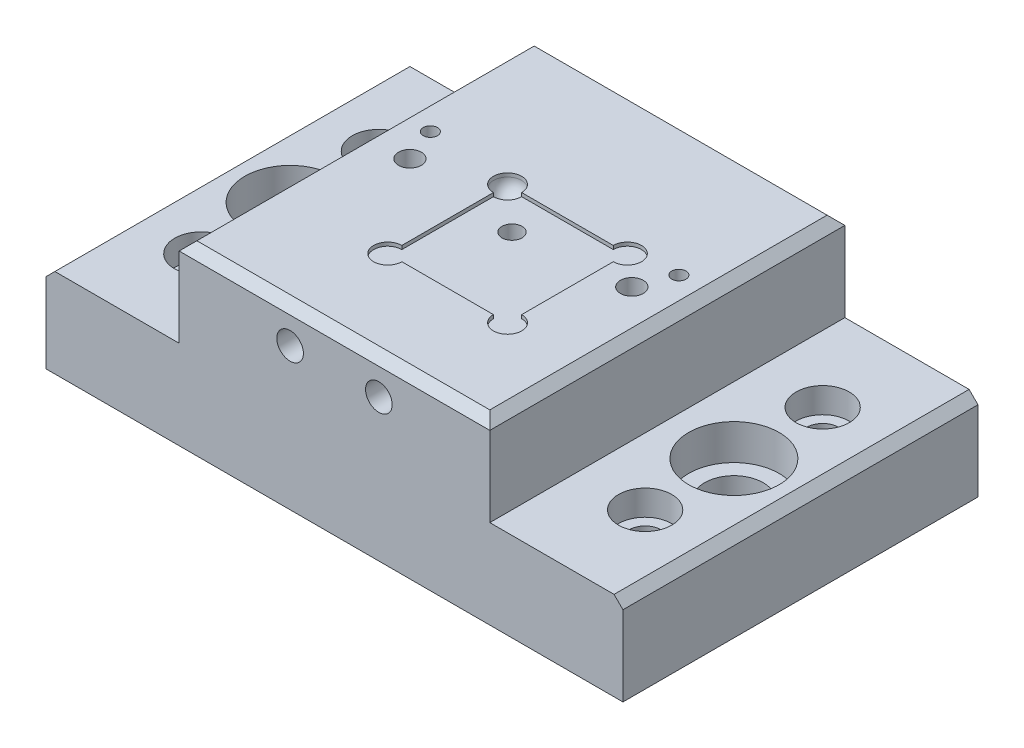
from build123d import *

# Parameters (mm, degrees)
BOSS_EXTRUDE1_DEPTH       = 40
CUT_EXTRUDE1_DEPTH        = 0.4064
SKETCH3_R                 = 1.8
CUT_EXTRUDE2_DEPTH        = 77.974021592
SKETCH5_R                 = 1.1303
CUT_EXTRUDE3_DEPTH        = 10
SKETCH7_R                 = 1.1303
CUT_EXTRUDE4_DEPTH        = 22
CHAMFER1_SIZE             = 1
SKETCH8_R                 = 1.5
CUT_EXTRUDE5_DEPTH        = 79.89866919
SKETCH10_R                = 0.8
CUT_EXTRUDE7_DEPTH        = 8
SKETCH12_R                = 3
CUT_EXTRUDE9_DEPTH        = 2.8448
SKETCH14_R                = 3.3
CUT_EXTRUDE11_DEPTH       = 77.974021592
SKETCH15_R                = 5.1
CUT_EXTRUDE12_DEPTH       = 4
SKETCH16_R                = 3.3
CUT_EXTRUDE13_DEPTH       = 77.974021592
SKETCH17_R                = 5.1
CUT_EXTRUDE14_DEPTH       = 4
F_5_40_TAPPED_HOLE1_D     = 2.5781
F_5_40_TAPPED_HOLE1_DEPTH = 15
F_5_40_TAPPED_HOLE1_TIP   = 0.774539381
SKETCH28_R                = 2.54
CUT_EXTRUDE15_DEPTH       = 5


with BuildPart() as part:
    # Sketch1 → Boss-Extrude1 (new body)
    with BuildSketch(Plane.XY):
        Polygon((0, 0), (65, 0), (65, 10), (50, 10), (50, 20), (15, 20), (15, 10), (0, 10), align=None)
    extrude(amount=BOSS_EXTRUDE1_DEPTH)

    # Sketch2 → Cut-Extrude1 (cut)
    with BuildSketch(Plane(origin=(0, 20, 0), x_dir=(1, 0, 0), z_dir=(0, 1, 0))):
        with BuildLine():
            Line((29.5875, -16), (39.91, -16))
            ThreePointArc((39.91, -16), (42.624299782, -14.875700218), (41.5, -17.59))
            Line((41.5, -17.59), (41.5, -27.91))
            ThreePointArc((41.5, -27.91), (42.624299782, -30.624299782), (39.91, -29.5))
            Line((39.91, -29.5), (29.59, -29.5))
            ThreePointArc((29.59, -29.5), (26.875700218, -30.624299782), (28, -27.91))
            Line((28, -27.91), (28, -17.5875))
            ThreePointArc((28, -17.5875), (26.877467985, -14.877467985), (29.5875, -16))
        make_face()
    extrude(amount=-CUT_EXTRUDE1_DEPTH, mode=Mode.SUBTRACT)

    # Sketch3 → Cut-Extrude2 (cut, through all)
    with BuildSketch(Plane(origin=(0, 10, 0), x_dir=(1, 0, 0), z_dir=(0, 1, 0))):
        with Locations(Location((7.5, -30, 0), (0, 0, 270))):
            Circle(SKETCH3_R)
        with Locations(Location((57.5, -30, 0), (0, 0, 270))):
            Circle(SKETCH3_R)
        with Locations(Location((7.5, -10, 0), (0, 0, 270))):
            Circle(SKETCH3_R)
        with Locations(Location((57.5, -10, 0), (0, 0, 270))):
            Circle(SKETCH3_R)
    extrude(amount=-CUT_EXTRUDE2_DEPTH, mode=Mode.SUBTRACT)

    # Sketch5 → Cut-Extrude3 (cut)
    with BuildSketch(Plane(origin=(0, 19.5936, 0), x_dir=(1, 0, 0), z_dir=(0, 1, 0))):
        with Locations(Location((32.5, -20, 0), (0, 0, 270))):
            Circle(SKETCH5_R)
    extrude(amount=-CUT_EXTRUDE3_DEPTH, mode=Mode.SUBTRACT)

    # Sketch7 → Cut-Extrude4 (cut)
    with BuildSketch(Plane.XY):
        with Locations((32.5, 10)):
            Circle(SKETCH7_R)
    extrude(amount=CUT_EXTRUDE4_DEPTH, mode=Mode.SUBTRACT)

    # Chamfer1
    chamfer1_edges = [part.edges().sort_by_distance(p)[0] for p in [
        (0, 10, 20),
        (15, 20, 20),
        (50, 20, 20),
        (65, 10, 20),
        (32.5, 20, 40),
        (32.5, 20, 0),
    ]]
    chamfer(chamfer1_edges, length=CHAMFER1_SIZE)

    # Sketch8 → Cut-Extrude5 (cut, through all)
    with BuildSketch(Plane(origin=(0, 0, 0), x_dir=(-1, 0, 0), z_dir=(0, 0, -1))):
        with Locations((-37.5, 16)):
            Circle(SKETCH8_R)
        with Locations((-27.5, 16)):
            Circle(SKETCH8_R)
    extrude(amount=-CUT_EXTRUDE5_DEPTH, mode=Mode.SUBTRACT)

    # Sketch10 → Cut-Extrude7 (cut)
    with BuildSketch(Plane(origin=(0, 20, 0), x_dir=(1, 0, 0), z_dir=(0, 1, 0))):
        with Locations(Location((18.5, -15.2, 0), (0, 0, 180))):
            Circle(SKETCH10_R)
        with Locations(Location((46.5, -15.2, 0), (0, 0, 180))):
            Circle(SKETCH10_R)
    extrude(amount=-CUT_EXTRUDE7_DEPTH, mode=Mode.SUBTRACT)

    # Sketch12 → Cut-Extrude9 (cut)
    with BuildSketch(Plane(origin=(0, 10, 0), x_dir=(1, 0, 0), z_dir=(0, 1, 0))):
        with Locations(Location((7.5, -30, 0), (0, 0, 270))):
            Circle(SKETCH12_R)
        with Locations(Location((57.5, -30, 0), (0, 0, 270))):
            Circle(SKETCH12_R)
        with Locations(Location((7.5, -10, 0), (0, 0, 270))):
            Circle(SKETCH12_R)
        with Locations(Location((57.5, -10, 0), (0, 0, 270))):
            Circle(SKETCH12_R)
    extrude(amount=-CUT_EXTRUDE9_DEPTH, mode=Mode.SUBTRACT)

    # Sketch14 → Cut-Extrude11 (cut, through all)
    with BuildSketch(Plane(origin=(0, 10, 0), x_dir=(1, 0, 0), z_dir=(0, 1, 0))):
        with Locations(Location((7.5, -20, 0), (0, 0, 270))):
            Circle(SKETCH14_R)
    extrude(amount=-CUT_EXTRUDE11_DEPTH, mode=Mode.SUBTRACT)

    # Sketch15 → Cut-Extrude12 (cut)
    with BuildSketch(Plane(origin=(0, 10, 0), x_dir=(1, 0, 0), z_dir=(0, 1, 0))):
        with Locations(Location((7.5, -20, 0), (0, 0, 270))):
            Circle(SKETCH15_R)
    extrude(amount=-CUT_EXTRUDE12_DEPTH, mode=Mode.SUBTRACT)

    # Sketch16 → Cut-Extrude13 (cut, through all)
    with BuildSketch(Plane(origin=(0, 10, 0), x_dir=(1, 0, 0), z_dir=(0, 1, 0))):
        with Locations(Location((57.5, -20, 0), (0, 0, 180))):
            Circle(SKETCH16_R)
    extrude(amount=-CUT_EXTRUDE13_DEPTH, mode=Mode.SUBTRACT)

    # Sketch17 → Cut-Extrude14 (cut)
    with BuildSketch(Plane(origin=(0, 10, 0), x_dir=(1, 0, 0), z_dir=(0, 1, 0))):
        with Locations(Location((57.5, -20, 0), (0, 0, 180))):
            Circle(SKETCH17_R)
    extrude(amount=-CUT_EXTRUDE14_DEPTH, mode=Mode.SUBTRACT)

    # Sketch19 → Cut-Revolve1 (revolve, cut)
    with BuildSketch(Plane(origin=(0, 19.5936, 0), x_dir=(1, 0, 0), z_dir=(0, 1, 0))):
        with BuildLine():
            Line((29.5875, -16), (26.4125, -16))
            ThreePointArc((26.4125, -16), (28, -17.5875), (29.5875, -16))
        make_face()
    revolve(axis=Axis((29.5875, 19.5936, 16), (-1, 0, 0)), mode=Mode.SUBTRACT)

    # #5-40 Tapped Hole1
    with Locations(Plane(origin=(0, 20, 0), x_dir=(1, 0, 0), z_dir=(0, 1, 0))):
        with Locations((20, -19), (45, -19)):
            Hole(F_5_40_TAPPED_HOLE1_D / 2, depth=F_5_40_TAPPED_HOLE1_DEPTH)
            with Locations((0, 0, -(F_5_40_TAPPED_HOLE1_DEPTH + F_5_40_TAPPED_HOLE1_TIP / 2))):  # 118° drill point
                Cone(0, F_5_40_TAPPED_HOLE1_D / 2, F_5_40_TAPPED_HOLE1_TIP, mode=Mode.SUBTRACT)

    # Sketch28 → Cut-Extrude15 (cut)
    with BuildSketch(Plane(origin=(0, 0, 0), x_dir=(-1, 0, 0), z_dir=(0, 0, -1))):
        with Locations((-32.5, 10)):
            Circle(SKETCH28_R)
    extrude(amount=-CUT_EXTRUDE15_DEPTH, mode=Mode.SUBTRACT)


solid = part.part
